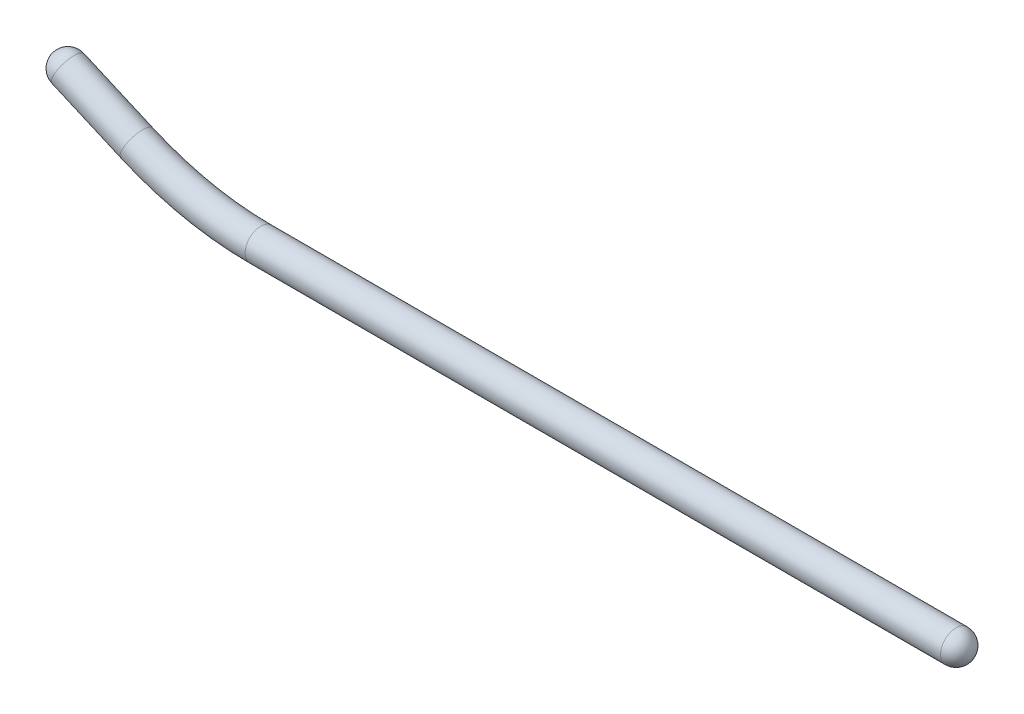
from build123d import *

# Parameters (mm, degrees)
SKETCH2_R = 1
FILLET1_R = 1


with BuildPart() as part:
    # Sweep1: sweep along a path in Sketch1
    with BuildLine(Plane.XY) as sweep1_path:
        Line((0, 0), (-45.82575695, 0))
        ThreePointArc((-45.82575695, 0), (-49.911949823, 0.421873741), (-53.82575695, 1.66969722))
        Line((-53.82575695, 1.66969722), (-59.16515139, 4))
    # Sketch2 → Sweep1 (sweep)
    with BuildSketch(Plane(origin=(0, 0, 0), x_dir=(0, 0, -1), z_dir=(1, 0, 0))):
        Circle(SKETCH2_R)
    sweep(path=sweep1_path.line)

    # Fillet1
    fillet1_edges = [part.edges().sort_by_distance(p)[0] for p in [
        (-59.16515139, 4, 1),
        (0, 0, 1),
    ]]
    fillet(fillet1_edges, radius=FILLET1_R)


solid = part.part
